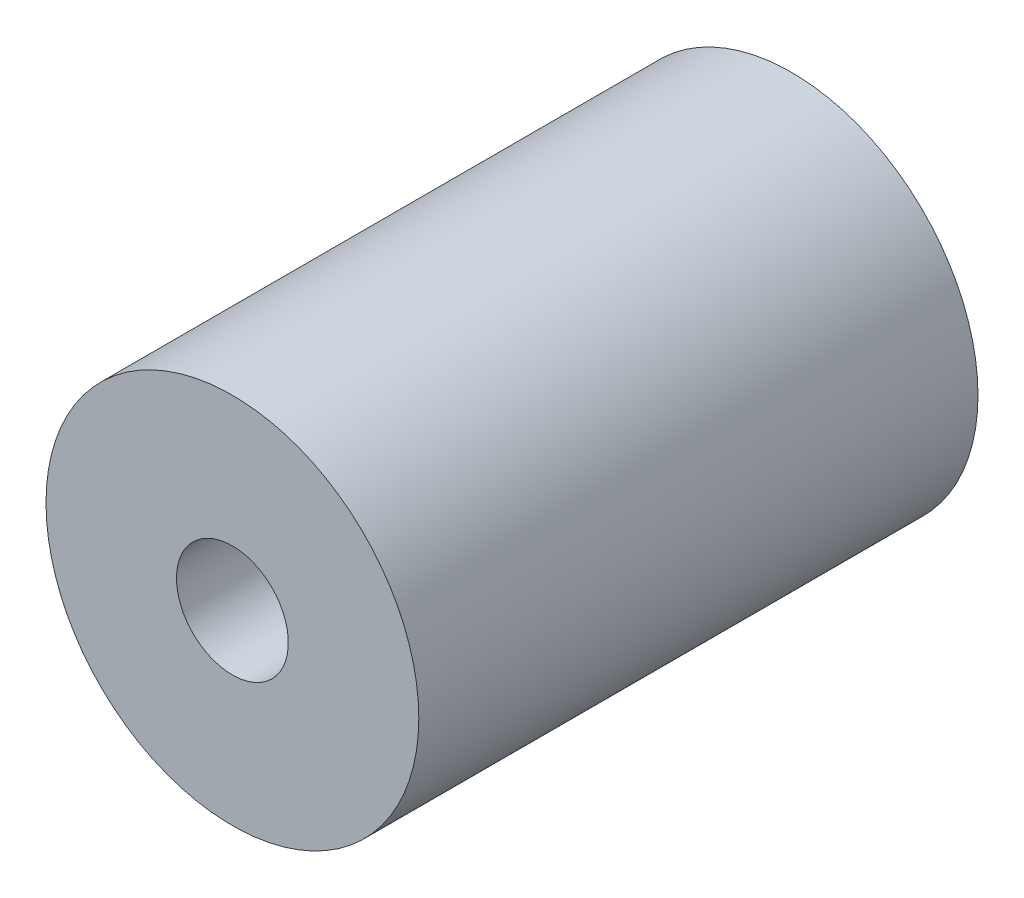
from build123d import *

# Parameters (mm, degrees)
SKETCH1_W             = 5
SKETCH1_H             = 15
F_3_0MM_DOWEL_HOLE1_D = 3


with BuildPart() as part:
    # Sketch1 → Revolve1 (revolve)
    with BuildSketch(Plane(origin=(0, 0, 0), x_dir=(1, 0, 0), z_dir=(0, 1, 0)), mode=Mode.PRIVATE) as revolve1_sk:
        with Locations((2.5, 7.5)):
            Rectangle(SKETCH1_W, SKETCH1_H)
    revolve(revolve1_sk.sketch.rotate(Axis((0, 0, -15), (0, 0, 1)), 180), axis=Axis((0, 0, -15), (0, 0, 1)))

    # Ø3.0mm Dowel Hole1 (through all)
    with Locations(Plane(origin=(0, 0, -15), x_dir=(-1, 0, 0), z_dir=(0, 0, -1))):
        with Locations((0, 0)):
            Hole(F_3_0MM_DOWEL_HOLE1_D / 2)


solid = part.part
